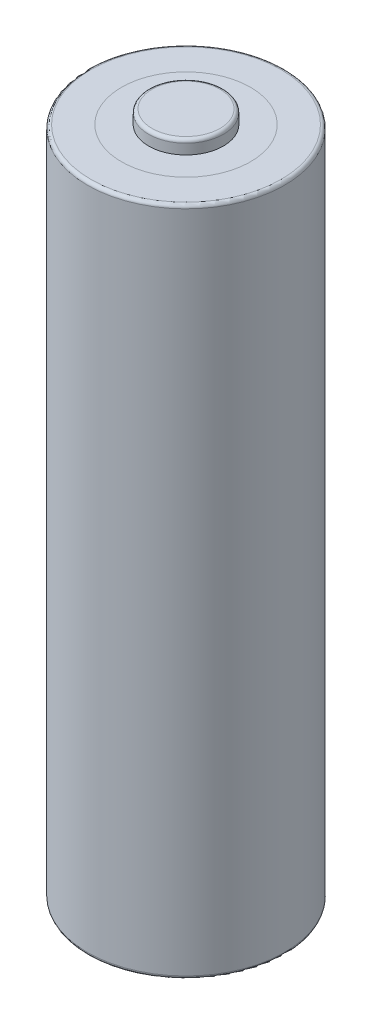
from build123d import *


with BuildPart() as part:
    # Sketch2 → Revolve1 (revolve)
    with BuildSketch(Plane(origin=(0, 0, 0), x_dir=(0, 0, -1), z_dir=(1, 0, 0)), mode=Mode.PRIVATE) as revolve1_sk:
        with BuildLine():
            Line((0, 0), (0, 50.5))
            Line((0, 50.5), (2.5, 50.5))
            ThreePointArc((2.5, 50.5), (2.676776695, 50.426776695), (2.75, 50.25))
            Line((2.75, 50.25), (2.75, 49.5))
            Line((2.75, 49.5), (7, 49.5))
            ThreePointArc((7, 49.5), (7.176776695, 49.426776695), (7.25, 49.25))
            Line((7.25, 49.25), (7.25, 0.35))
            ThreePointArc((7.25, 0.35), (7.176776695, 0.173223305), (7, 0.1))
            Line((7, 0.1), (3.5, 0.1))
            Line((3.5, 0.1), (3, 0))
            Line((3, 0), (0, 0))
        make_face()
    revolve(revolve1_sk.sketch.rotate(Axis((0, 0, 0), (0, -1, 0)), 180), axis=Axis((0, 0, 0), (0, -1, 0)))


solid = part.part
